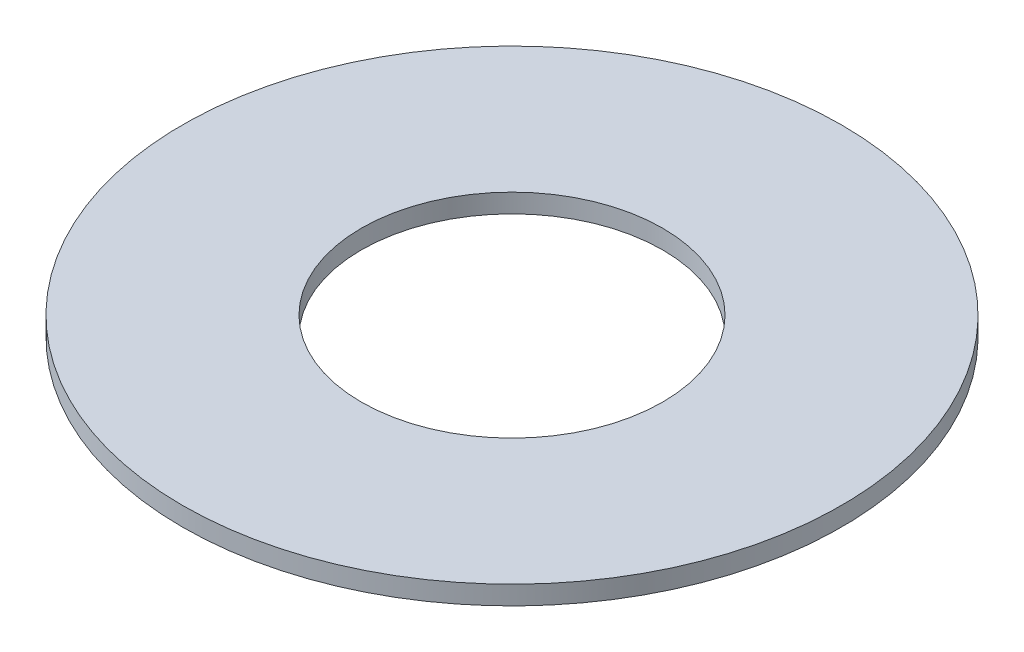
from build123d import *

# Parameters (mm, degrees)
SKETCH3_R           = 3.5
SKETCH3_R_2         = 1.6
BOSS_EXTRUDE1_DEPTH = 0.2


with BuildPart() as part:
    # Sketch3 → Boss-Extrude1 (new body)
    with BuildSketch(Plane(origin=(0, 0, 0), x_dir=(1, 0, 0), z_dir=(0, 1, 0))):
        with Locations(Location((0, 0, 0), (0, 0, 270))):
            Circle(SKETCH3_R)
        with Locations(Location((0, 0, 0), (0, 0, 270))):
            Circle(SKETCH3_R_2, mode=Mode.SUBTRACT)
    extrude(amount=BOSS_EXTRUDE1_DEPTH)


solid = part.part
